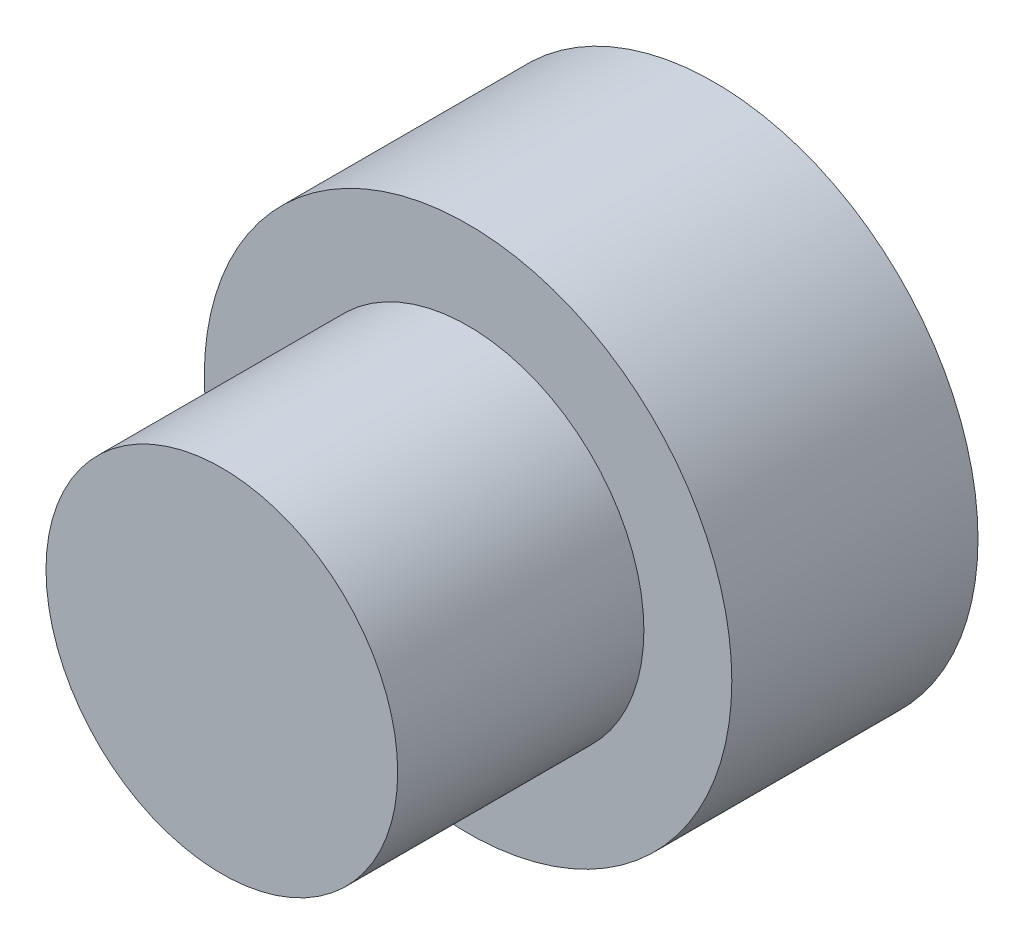
from build123d import *

# Parameters (mm, degrees)
SKETCH1_R           = 7.5
BOSS_EXTRUDE1_DEPTH = 7
SKETCH2_R           = 5
BOSS_EXTRUDE2_DEPTH = 7
SKETCH3_R           = 2.5
CUT_EXTRUDE1_DEPTH  = 6


with BuildPart() as part:
    # Sketch1 → Boss-Extrude1 (new body)
    with BuildSketch(Plane.XY):
        Circle(SKETCH1_R)
    extrude(amount=BOSS_EXTRUDE1_DEPTH)

    # Sketch2 → Boss-Extrude2 (add)
    with BuildSketch(Plane.XY.offset(7)):
        Circle(SKETCH2_R)
    extrude(amount=BOSS_EXTRUDE2_DEPTH)

    # Sketch3 → Cut-Extrude1 (cut)
    with BuildSketch(Plane(origin=(0, 0, 0), x_dir=(-1, 0, 0), z_dir=(0, 0, -1))):
        Circle(SKETCH3_R)
    extrude(amount=-CUT_EXTRUDE1_DEPTH, mode=Mode.SUBTRACT)


solid = part.part
